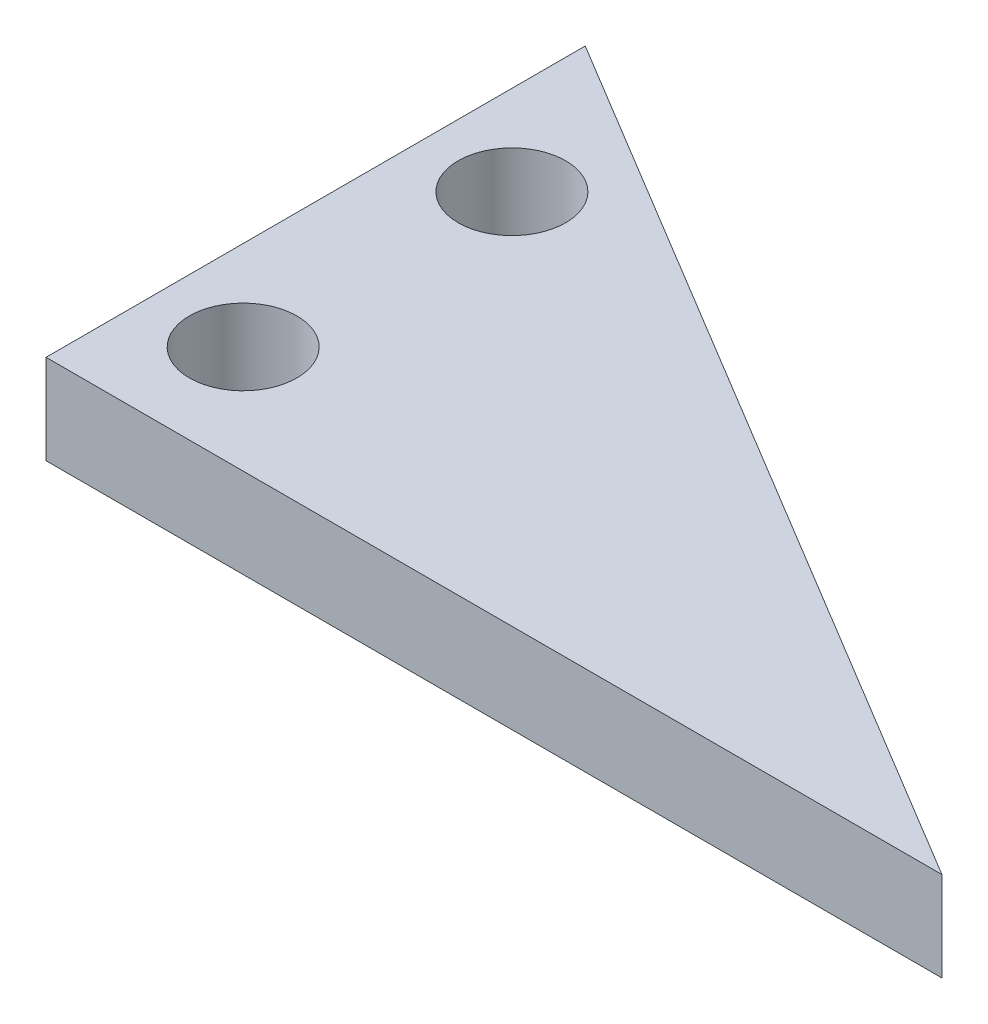
from build123d import *

# Parameters (mm, degrees)
SKETCH1_R           = 1.524
BOSS_EXTRUDE1_DEPTH = 2.54


with BuildPart() as part:
    # Sketch1 → Boss-Extrude1 (new body)
    with BuildSketch(Plane(origin=(0, 0, 0), x_dir=(1, 0, 0), z_dir=(0, 1, 0))):
        Polygon((0, 0), (25.4, 0), (0, 15.285917978), align=None)
        with Locations(Location((2.54, 3.048, 0), (0, 0, 270))):
            Circle(SKETCH1_R, mode=Mode.SUBTRACT)
        with Locations(Location((2.54, 10.668, 0), (0, 0, 270))):
            Circle(SKETCH1_R, mode=Mode.SUBTRACT)
    extrude(amount=BOSS_EXTRUDE1_DEPTH)


solid = part.part
